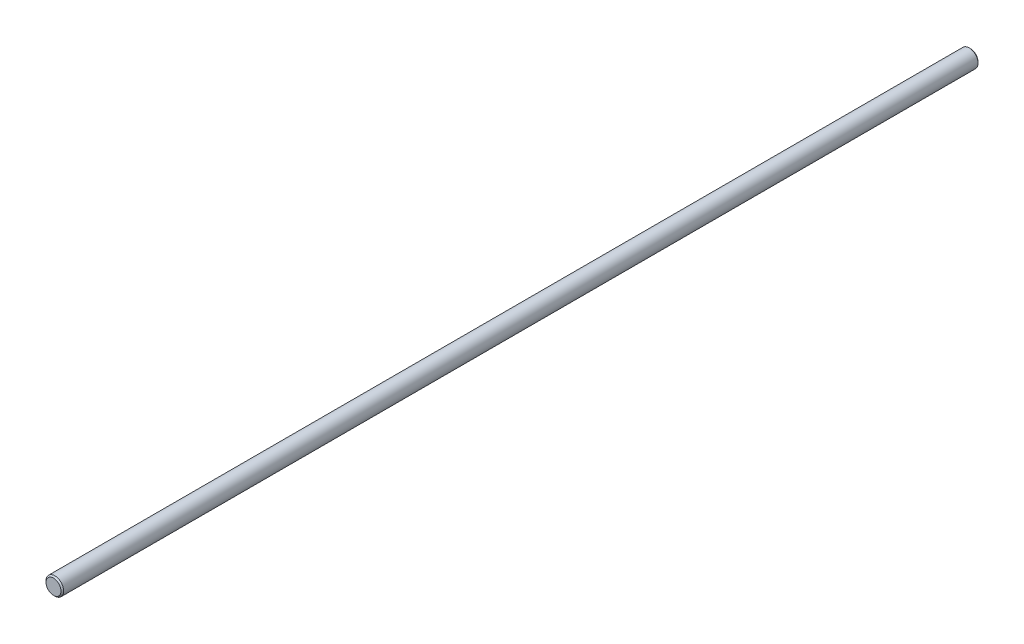
from build123d import *

# Parameters (mm, degrees)
BOSS_EXTRUDE1_DEPTH      = 206.3115
BOSS_EXTRUDE1_DEPTH_BACK = 206.3115
SKETCH2_R                = 3.96875
CHAMFER1_SIZE            = 0.5953125


with BuildPart() as part:
    # Sketch2 → Boss-Extrude1 (new, two sides: drawn at the far end of the back side and taken through both)
    with BuildSketch(Plane.XY.offset(-BOSS_EXTRUDE1_DEPTH_BACK)):
        Circle(SKETCH2_R)
    extrude(amount=BOSS_EXTRUDE1_DEPTH + BOSS_EXTRUDE1_DEPTH_BACK)

    # Chamfer1
    chamfer1_edges = [part.edges().sort_by_distance(p)[0] for p in [
        (-3.96875, 0, -206.3115),
        (-3.96875, 0, 206.3115),
    ]]
    chamfer(chamfer1_edges, length=CHAMFER1_SIZE)


solid = part.part
